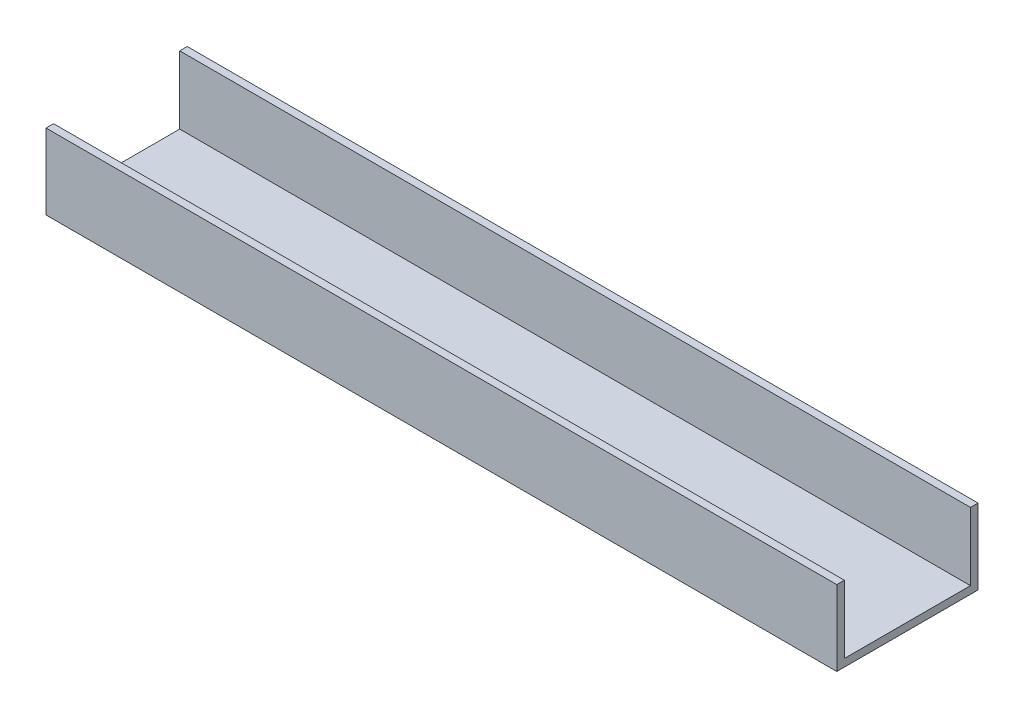
from build123d import *

# Parameters (mm, degrees)
SKETCH_1_W      = 420
SKETCH_1_H      = 75
EXTRUDE_1_DEPTH = 4
SKETCH_2_W      = 420
SKETCH_2_H      = 4
EXTRUDE_2_DEPTH = 36


with BuildPart() as part:
    # 스케치1 → 보스-돌출1 (new body)
    with BuildSketch(Plane(origin=(0, 0, 0), x_dir=(1, 0, 0), z_dir=(0, 1, 0))):
        with Locations((210, 37.5)):
            Rectangle(SKETCH_1_W, SKETCH_1_H)
    extrude(amount=EXTRUDE_1_DEPTH)

    # 스케치2 → 보스-돌출2 (add)
    with BuildSketch(Plane(origin=(0, 4, 0), x_dir=(1, 0, 0), z_dir=(0, 1, 0))):
        with Locations((210, 2)):
            Rectangle(SKETCH_2_W, SKETCH_2_H)
        with Locations((210, 73)):
            Rectangle(SKETCH_2_W, SKETCH_2_H)
    extrude(amount=EXTRUDE_2_DEPTH)


solid = part.part
